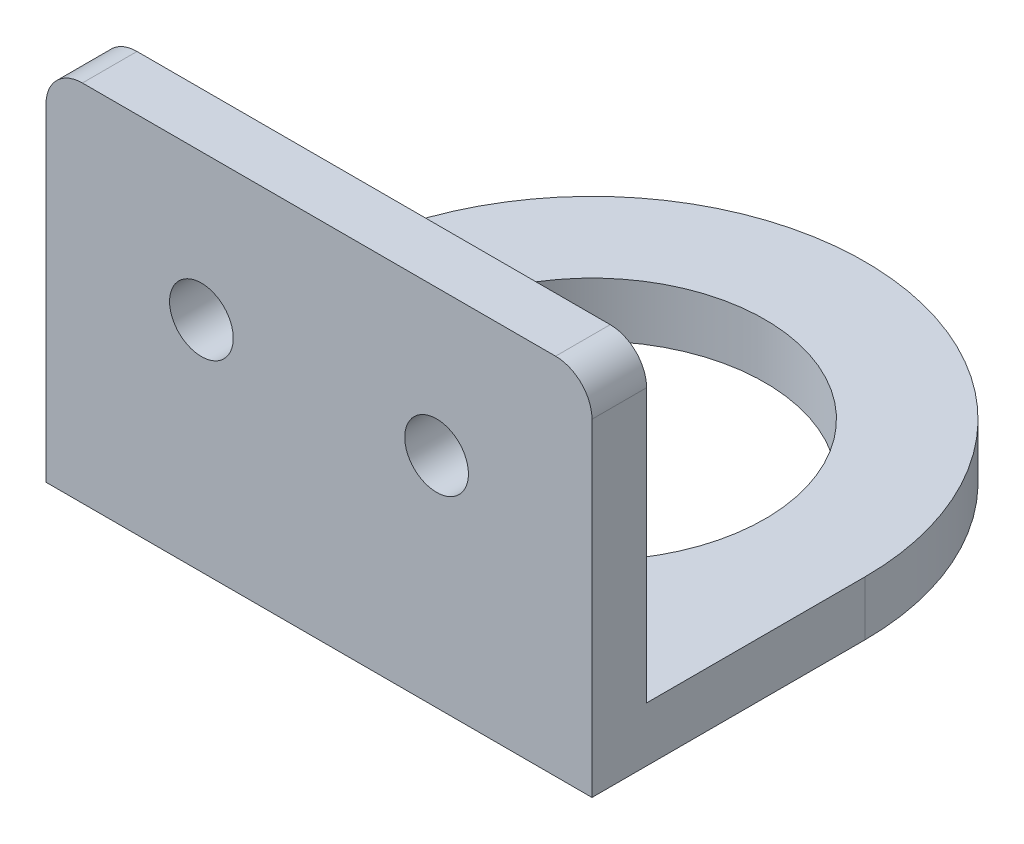
from build123d import *

# Parameters (mm, degrees)
SKETCH_1_R          = 9.5
EXTRUDE_2_DEPTH     = 3
SKETCH_9_W          = 30
SKETCH_9_H          = 20
EXTRUDE_3_DEPTH     = 3
SKETCH_10_R         = 1.75
CUT_EXTRUDE_1_DEPTH = 37.796738986
FILLET_6_R          = 2


with BuildPart() as part:
    # 草图1 → 凸台-拉伸2 (new body)
    with BuildSketch(Plane(origin=(0, 0, 0), x_dir=(1, 0, 0), z_dir=(0, 1, 0))):
        with BuildLine():
            Line((15, -15), (15, 0))
            ThreePointArc((15, 0), (0, 15), (-15, 0))
            Line((-15, 0), (-15, -15))
            Line((-15, -15), (15, -15))
        make_face()
        with Locations(Location((0, 0, 0), (0, 0, 270))):
            Circle(SKETCH_1_R, mode=Mode.SUBTRACT)
    extrude(amount=EXTRUDE_2_DEPTH)

    # 草图9 → 凸台-拉伸3 (add)
    with BuildSketch(Plane.XY.offset(15)):
        with Locations((0, 10)):
            Rectangle(SKETCH_9_W, SKETCH_9_H)
    extrude(amount=-EXTRUDE_3_DEPTH)

    # 草图10 → 切除-拉伸1 (cut, through all)
    with BuildSketch(Plane(origin=(0, 0, 12), x_dir=(-1, 0, 0), z_dir=(0, 0, -1))):
        with Locations((6.461379144, 12)):
            Circle(SKETCH_10_R)
        with Locations(Location((-6.461379144, 12, 0), (0, 0, 180))):
            Circle(SKETCH_10_R)
    extrude(amount=-CUT_EXTRUDE_1_DEPTH, mode=Mode.SUBTRACT)

    # 圆角6
    fillet_6_edges = [part.edges().sort_by_distance(p)[0] for p in [
        (-15, 20, 13.5),
        (15, 20, 13.5),
    ]]
    fillet(fillet_6_edges, radius=FILLET_6_R)


solid = part.part
